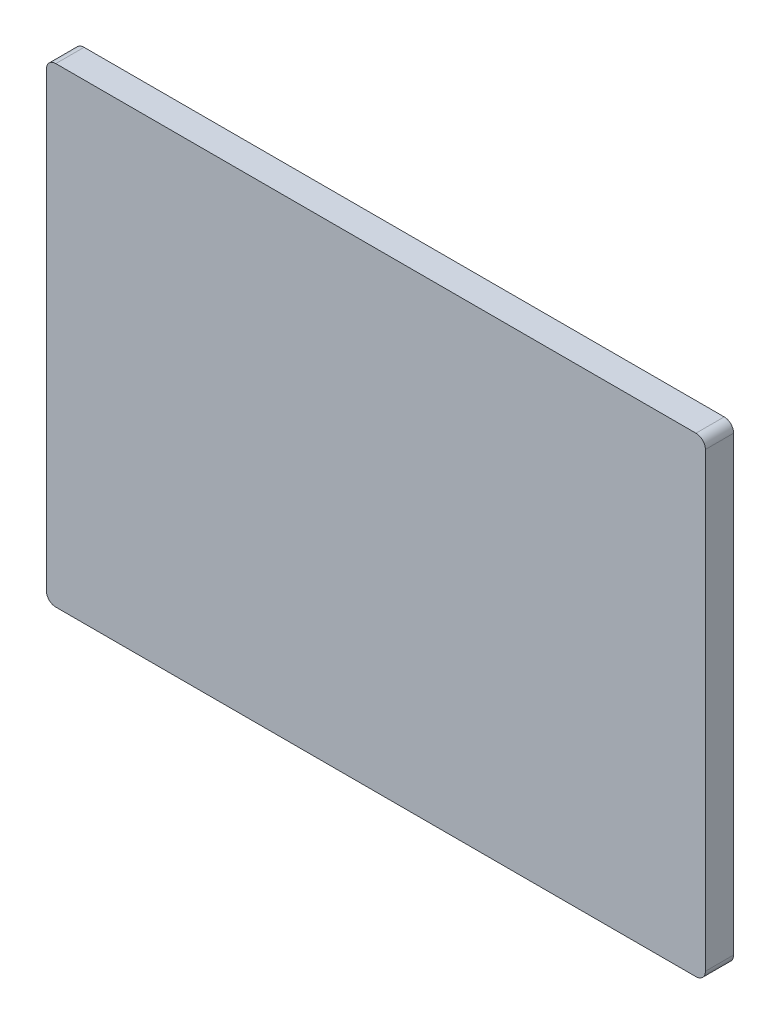
from build123d import *

# Parameters (mm, degrees)
ESQUISSE1_W        = 350
ESQUISSE1_H        = 250
BOSS_EXTRU_1_DEPTH = 15
CONG_1_R           = 5


with BuildPart() as part:
    # Esquisse1 → Boss.-Extru.1 (new body)
    with BuildSketch(Plane.XY):
        Rectangle(ESQUISSE1_W, ESQUISSE1_H)
    extrude(amount=BOSS_EXTRU_1_DEPTH)

    # Congé1
    cong_1_edges = [part.edges().sort_by_distance(p)[0] for p in [
        (-175, 125, 7.5),
        (175, 125, 7.5),
        (175, -125, 7.5),
        (-175, -125, 7.5),
    ]]
    fillet(cong_1_edges, radius=CONG_1_R)


solid = part.part
